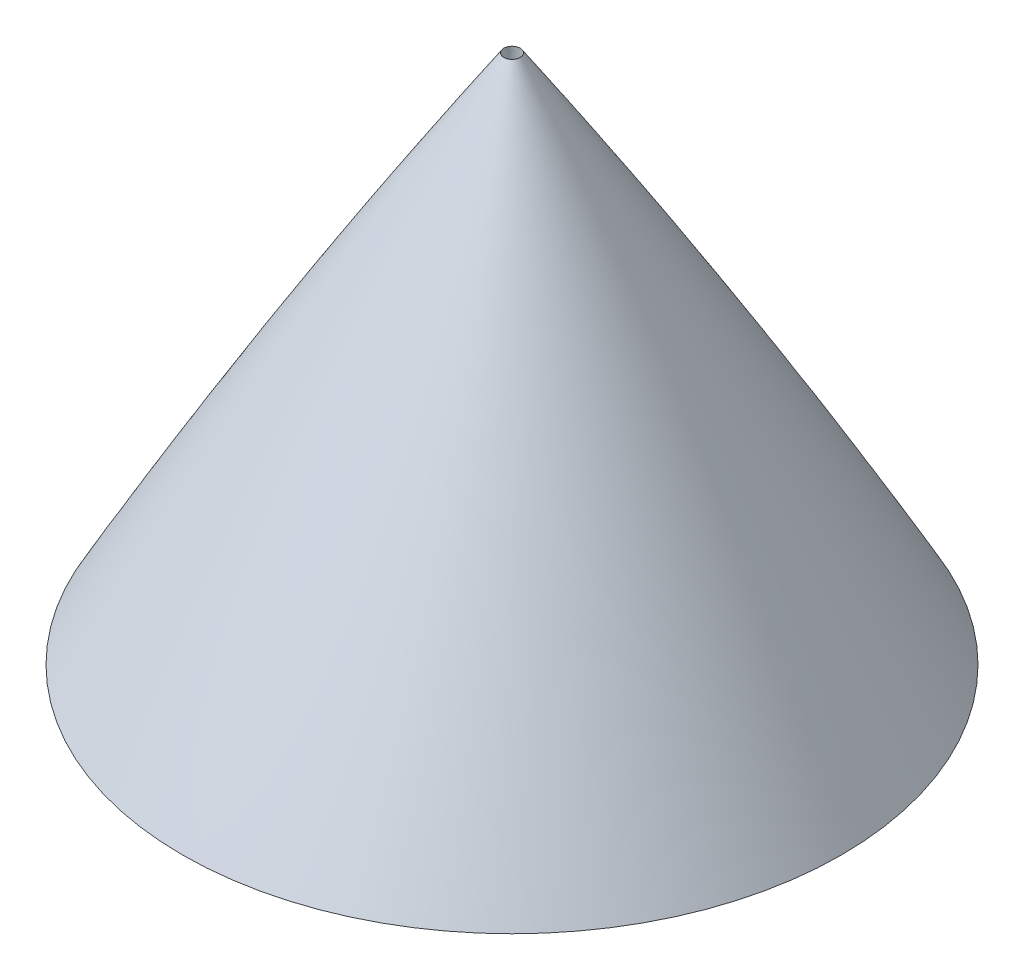
from build123d import *

# Parameters (mm, degrees)
BOSS_EXTRUDE1_START = -300
SKETCH2_R           = 65.685518314
SKETCH2_R_2         = 57.685518314
BOSS_EXTRUDE1_DEPTH = 300
SKETCH3_R           = 120.726600854
CUT_EXTRUDE1_DEPTH  = 532.239063666


with BuildPart() as part:
    # Sketch1 → Revolve3 (revolve)
    with BuildSketch(Plane.XY, mode=Mode.PRIVATE) as revolve3_sk:
        with BuildLine():
            Line((75.685518314, -0.344450695), (75.685518314, 149.655549305))
            add(Edge.make_bspline(
                [(0.458845088, 400), (0.666505615, 399.685666805), (1.083577622, 399.052178662), (1.970059475, 397.700550841), (2.936759655, 396.211212549), (3.902634821, 394.710095548), (4.880100736, 393.178406868), (5.844047989, 391.654155139), (6.803360265, 390.123894266), (7.761821662, 388.581395307), (8.719237727, 387.026713906), (16.64656029, 374.037008419), (28.257300922, 353.014913091), (42.102023433, 323.258697722), (56.610767976, 282.331206247), (67.05955857, 242.08025425), (72.334052865, 209.220016816), (74.5835291, 183.923611768), (75.273053413, 169.173424136), (75.397271583, 165.955632222), (75.484778379, 163.208321649), (75.535317822, 161.393000412), (75.578401528, 159.587415566), (75.614305657, 157.784317211), (75.643029642, 155.967426667), (75.664573028, 154.18293971), (75.678935474, 152.40648291), (75.684321434, 150.790982345), (75.685518314, 150.032282914), (75.685518314, 149.655549305)],
                knots=[0.082616428, 0.082616428, 0.082616428, 0.082616428, 0.082616428, 0.088299706, 0.093982984, 0.099666263, 0.105349541, 0.111032819, 0.116716097, 0.122399375, 0.128082653, 0.133891142, 0.139699631, 0.313954311, 0.430124092, 0.546293874, 0.685697612, 0.836718331, 0.848335309, 0.865760775, 0.871569264, 0.877252541, 0.882935819, 0.888619096, 0.894302373, 0.899985651, 0.905668928, 0.911352205, 0.917035483, 0.917035483, 0.917035483, 0.917035483, 0.917035483], degree=4))
            Line((0.458845088, 400), (0.43750857, 381.399188372))
            add(Edge.make_bspline(
                [(0.43750857, 381.399188372), (0.55852927, 381.201299105), (3.495430864, 376.390848647), (11.792504456, 362.199887034), (29.079217345, 328.534275172), (48.408588041, 277.933780444), (60.172497106, 225.059949932), (64.30600489, 187.441870002), (65.266674131, 169.911010475), (65.525365527, 161.807957388), (65.602345571, 158.438692592), (65.640090713, 156.064661932), (65.657046141, 154.723430387), (65.667429233, 153.726401125), (65.675476765, 152.707134592), (65.68126504, 151.595575293), (65.684757556, 150.498770837), (65.685518314, 149.951992083), (65.685518314, 149.655549305)],
                knots=[0.132529105, 0.132529105, 0.132529105, 0.132529105, 0.134767619, 0.18691881, 0.291221192, 0.499825955, 0.708430719, 0.812733101, 0.864884292, 0.877922089, 0.890959887, 0.897478786, 0.900738235, 0.903997685, 0.907257134, 0.910516584, 0.913776033, 0.917035483, 0.917035483, 0.917035483, 0.917035483], degree=3))
            Line((65.685518314, 149.655549305), (65.685518314, -0.344450695))
            Line((65.685518314, -0.344450695), (75.685518314, -0.344450695))
        make_face()
    revolve(revolve3_sk.sketch.rotate(Axis((0, -198.817850362, 0), (0, -1, 0)), 270), axis=Axis((0, -198.817850362, 0), (0, -1, 0)))

    # Sketch2 → Boss-Extrude1 (add)
    with BuildSketch(Plane(origin=(0, 149.655549305, 0), x_dir=(1, 0, 0), z_dir=(0, 1, 0)).offset(BOSS_EXTRUDE1_START)):
        with Locations(Location((0, 0, 0), (0, 0, 270))):
            Circle(SKETCH2_R)
        with Locations(Location((0, 0, 0), (0, 0, 270))):
            Circle(SKETCH2_R_2, mode=Mode.SUBTRACT)
    extrude(amount=BOSS_EXTRUDE1_DEPTH)

    # Sketch3 → Cut-Extrude1 (cut, through all)
    with BuildSketch(Plane(origin=(0, 370, 0), x_dir=(-1, 0, 0), z_dir=(0, -1, 0))):
        Circle(SKETCH3_R)
    extrude(amount=CUT_EXTRUDE1_DEPTH, mode=Mode.SUBTRACT)


solid = part.part
